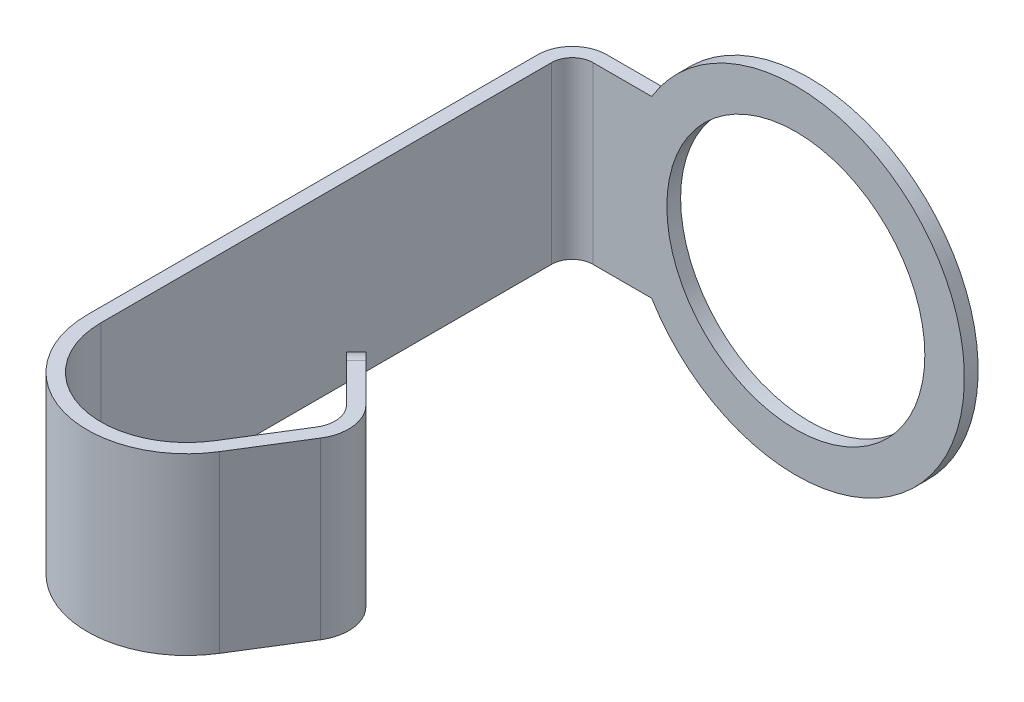
from build123d import *

# Parameters (mm, degrees)
SKETCH1_R           = 6.223
SKETCH1_R_2         = 4.7625
EXTRUDE1_DEPTH      = 0.508
EXTRUDE2_DEPTH      = 3.2258
EXTRUDE2_DEPTH_BACK = 3.2258
SKETCH3_W           = 0.901351443
SKETCH3_H           = 6.4516
EXTRUDE3_DEPTH      = 0.508
FILLET1_R           = 1.27


with BuildPart() as part:
    # Sketch1 → Extrude1 (new body)
    with BuildSketch(Plane.XY):
        Circle(SKETCH1_R)
        Circle(SKETCH1_R_2, mode=Mode.SUBTRACT)
    extrude(amount=EXTRUDE1_DEPTH)



with BuildPart() as body_2:
    # Sketch2 → Extrude2 (new, two sides: drawn at the far end of the back side and taken through both)
    with BuildSketch(Plane(origin=(0, 0, 0), x_dir=(1, 0, 0), z_dir=(0, 1, 0)).offset(-EXTRUDE2_DEPTH_BACK)):
        with BuildLine():
            Line((-6.223, 0), (-7.493, 0))
            ThreePointArc((-7.493, 0), (-8.391025612, -0.371974388), (-8.763, -1.27))
            Line((-8.763, -1.27), (-8.763, -17.907))
            ThreePointArc((-8.763, -17.907), (-6.08420147, -21.450454304), (-1.94460825, -19.839306284))
            Line((-1.94460825, -19.839306284), (-0.512193665, -17.537255749))
            ThreePointArc((-0.512193665, -17.537255749), (-0.292109819, -16.558154348), (-0.728518239, -15.654481761))
            Line((-0.728518239, -15.654481761), (-3.048, -13.335))
            Line((-3.048, -13.335), (-3.407210245, -13.694210245))
            Line((-3.407210245, -13.694210245), (-1.087728484, -16.013692006))
            ThreePointArc((-1.087728484, -16.013692006), (-0.796789537, -16.616140397), (-0.943512101, -17.268874664))
            Line((-0.943512101, -17.268874664), (-2.376524764, -19.571886378))
            ThreePointArc((-2.376524764, -19.571886378), (-5.945185277, -20.961845239), (-8.255, -17.907))
            Line((-8.255, -17.907), (-8.255, -1.27))
            ThreePointArc((-8.255, -1.27), (-8.031815367, -0.731184633), (-7.493, -0.508))
            Line((-7.493, -0.508), (-6.223, -0.508))
            Line((-6.223, -0.508), (-6.223, 0))
        make_face()
    extrude(amount=EXTRUDE2_DEPTH + EXTRUDE2_DEPTH_BACK)


with BuildPart() as part_1:
    add(part.part)

    add(body_2.part)  # Extrude3 merges body 2
    # Sketch3 → Extrude3 (add)
    with BuildSketch(Plane(origin=(0, 0, 0), x_dir=(-1, 0, 0), z_dir=(0, 0, -1))):
        with Locations((5.772324279, 0)):
            Rectangle(SKETCH3_W, SKETCH3_H)
    extrude(amount=-EXTRUDE3_DEPTH)

    # Fillet1
    fillet1_edges = [part_1.edges().sort_by_distance(p)[0] for p in [
        (-3.227605122, 3.2258, 13.514605122),
        (-3.227605122, -3.2258, 13.514605122),
    ]]
    fillet(fillet1_edges, radius=FILLET1_R)


solid = part_1.part
